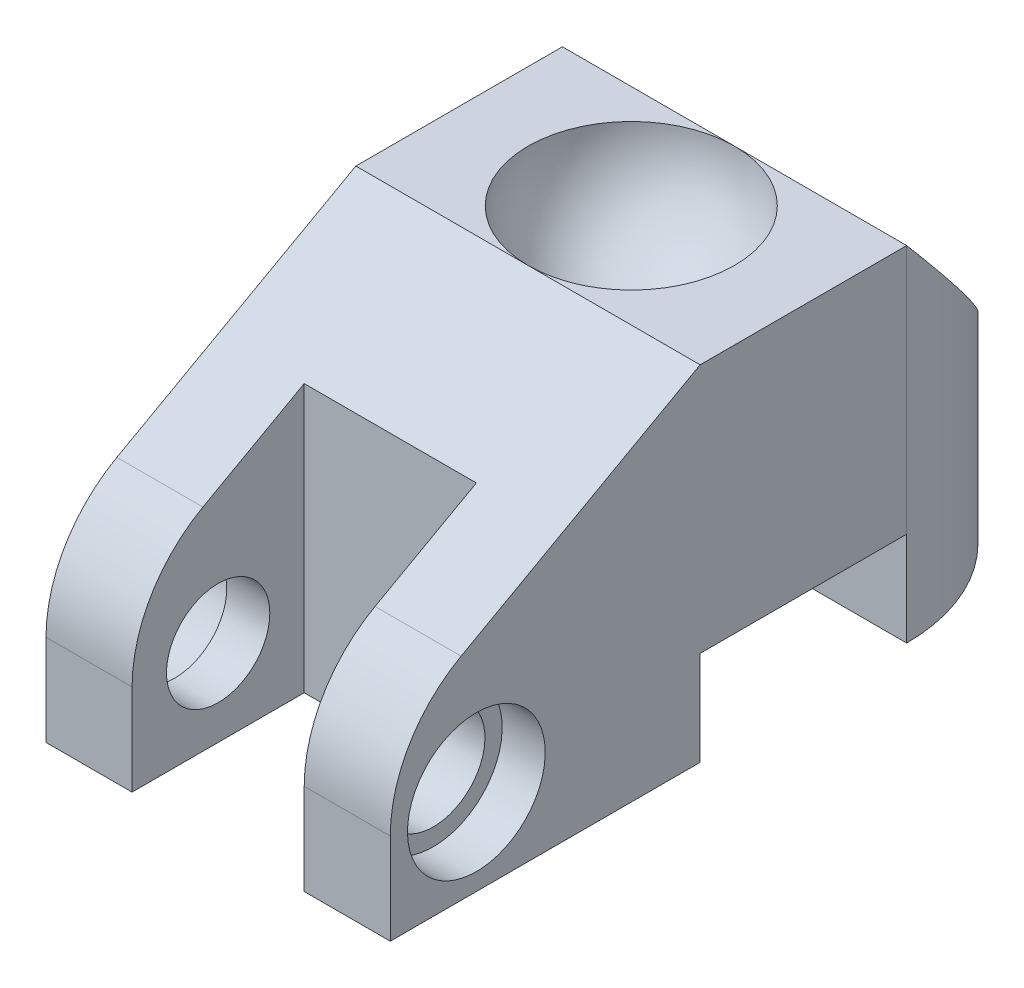
from build123d import *

# Parameters (mm, degrees)
SKETCH5_W           = 20
SKETCH5_H           = 20
BOSS_EXTRUDE1_DEPTH = 40
SKETCH7_W           = 12
SKETCH7_H           = 5.480254557
CUT_EXTRUDE3_DEPTH  = 20
SKETCH8_W           = 10
SKETCH8_H           = 10
CUT_EXTRUDE5_DEPTH  = 20
SKETCH12_R          = 3
CUT_EXTRUDE9_DEPTH  = 20
SKETCH16_R          = 4
CUT_EXTRUDE10_DEPTH = 2.5
CUT_EXTRUDE11_START = -2.5
SKETCH17_R          = 4
CUT_EXTRUDE11_DEPTH = 2.5
FILLET8_R           = 8
SKETCH18_R          = 6.023611462
BOSS_EXTRUDE2_DEPTH = 3
SKETCH19_R          = 4
CUT_EXTRUDE12_DEPTH = 10


with BuildPart() as part:
    # Sketch5 → Boss-Extrude1 (new body)
    with BuildSketch(Plane.XY):
        with Locations((0.782482396, -0.960509114)):
            Rectangle(SKETCH5_W, SKETCH5_H)
    extrude(amount=BOSS_EXTRUDE1_DEPTH)

    # Sketch7 → Cut-Extrude3 (cut)
    with BuildSketch(Plane(origin=(10.782482396, 0, 0), x_dir=(0, 0, -1), z_dir=(1, 0, 0))):
        Polygon((-40, 9.039490886), (-40, -0.960509114), (-22, 9.039490886), align=None)
        with Locations((-16, -8.220381835)):
            Rectangle(SKETCH7_W, SKETCH7_H)
        Polygon((-10, 9.039490886), (0, -2.740127279), (0, 9.039490886), align=None)
    extrude(amount=-CUT_EXTRUDE3_DEPTH, mode=Mode.SUBTRACT)

    # Sketch8 → Cut-Extrude5 (cut)
    with BuildSketch(Plane.XZ.offset(10.960509114)):
        with BuildLine():
            Line((-9.217517604, 0), (0.78248238, 0))
            ThreePointArc((0.78248238, 0), (-6.288585421, 2.928932194), (-9.217517604, 10))
            Line((-9.217517604, 10), (-9.217517604, 0))
        make_face()
        with BuildLine():
            Line((10.782482396, 0), (10.782482396, 10))
            ThreePointArc((10.782482396, 10), (7.853550202, 2.928932182), (0.78248238, 0))
            Line((0.78248238, 0), (10.782482396, 0))
        make_face()
        with Locations((0.782482396, 35)):
            Rectangle(SKETCH8_W, SKETCH8_H)
    extrude(amount=-CUT_EXTRUDE5_DEPTH, mode=Mode.SUBTRACT)

    # Sketch10 → Cut-Revolve2 (revolve, cut)
    with BuildSketch(Plane(origin=(0, 9.039490886, 0), x_dir=(1, 0, 0), z_dir=(0, 1, 0))):
        with BuildLine():
            Line((-5.217517604, -16), (6.782482396, -16))
            ThreePointArc((6.782482396, -16), (0.782482396, -22), (-5.217517604, -16))
        make_face()
    revolve(axis=Axis((-5.217517604, 9.039490886, 16), (1, 0, 0)), mode=Mode.SUBTRACT)

    # Sketch12 → Cut-Extrude9 (cut)
    with BuildSketch(Plane(origin=(10.782482396, 0, 0), x_dir=(0, 0, -1), z_dir=(1, 0, 0))):
        with Locations(Location((-35, -5.960509114, 0), (0, 0, 90))):
            Circle(SKETCH12_R)
    extrude(amount=-CUT_EXTRUDE9_DEPTH, mode=Mode.SUBTRACT)

    # Sketch16 → Cut-Extrude10 (cut)
    with BuildSketch(Plane(origin=(10.782482396, 0, 0), x_dir=(0, 0, -1), z_dir=(1, 0, 0))):
        with Locations(Location((-35, -5.960509114, 0), (0, 0, 90))):
            Circle(SKETCH16_R)
    extrude(amount=-CUT_EXTRUDE10_DEPTH, mode=Mode.SUBTRACT)

    # Sketch17 → Cut-Extrude11 (cut)
    with BuildSketch(Plane.ZY.offset(9.217517604).offset(CUT_EXTRUDE11_START)):
        with Locations(Location((35, -5.960509114, 0), (0, 0, 90))):
            Circle(SKETCH17_R)
    extrude(amount=CUT_EXTRUDE11_DEPTH, mode=Mode.SUBTRACT)

    # Fillet8
    fillet8_edges = [part.edges().sort_by_distance(p)[0] for p in [
        (-6.717517604, -0.960509114, 40),
        (8.282482396, -0.960509114, 40),
    ]]
    fillet(fillet8_edges, radius=FILLET8_R)

    # Sketch18 → Boss-Extrude2 (add)
    with BuildSketch(Plane(origin=(0, -5.480254557, 0), x_dir=(-1, 0, 0), z_dir=(0, -1, 0))):
        with Locations((-0.782482396, -16)):
            Circle(SKETCH18_R)
    extrude(amount=BOSS_EXTRUDE2_DEPTH)

    # Sketch19 → Cut-Extrude12 (cut)
    with BuildSketch(Plane(origin=(0, -8.480254557, 0), x_dir=(-1, 0, 0), z_dir=(0, -1, 0))):
        with Locations(Location((-0.782482396, -16, 0), (0, 0, 180))):
            Circle(SKETCH19_R)
    extrude(amount=-CUT_EXTRUDE12_DEPTH, mode=Mode.SUBTRACT)


solid = part.part
